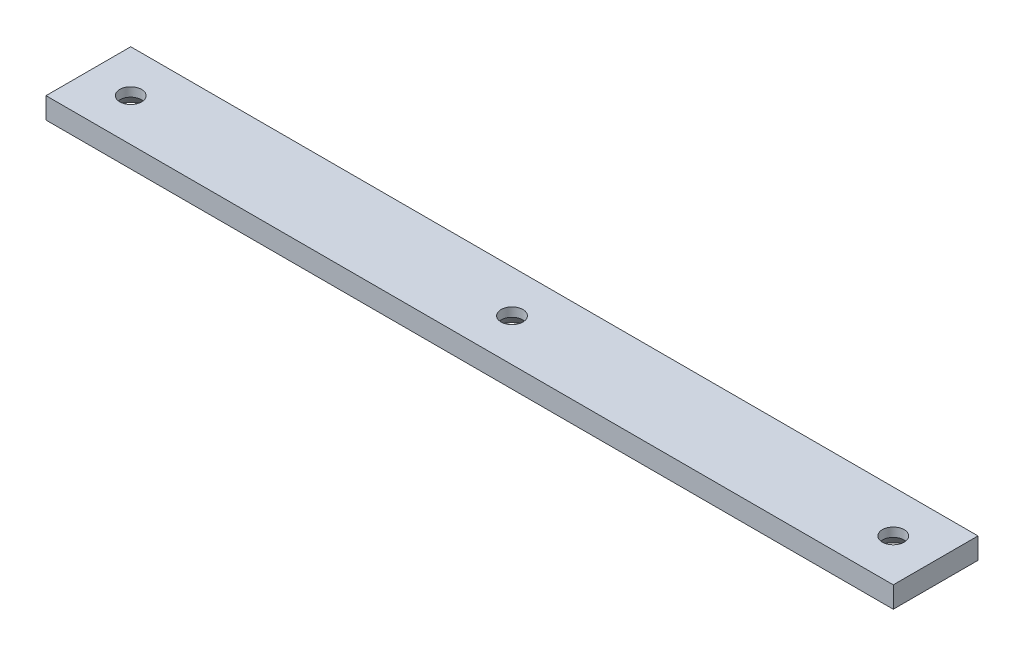
from build123d import *

# Parameters (mm, degrees)
SKETCH1_W                                     = 254
SKETCH1_H                                     = 25.4
BOSS_EXTRUDE1_DEPTH                           = 6.35
CSK_FOR_1_4_FLAT_HEAD_MACHINE_SCREW1_AT_COUNT = 2
CSK_FOR_1_4_FLAT_HEAD_MACHINE_SCREW1_AT_PITCH = 228.6
CSK_FOR_1_4_FLAT_HEAD_MACHINE_SCREW1_2_COUNT  = 2
CSK_FOR_1_4_FLAT_HEAD_MACHINE_SCREW1_2_PITCH  = 114.3


with BuildPart() as part:
    # Sketch1 → Boss-Extrude1 (new body)
    with BuildSketch(Plane(origin=(0, 0, 0), x_dir=(1, 0, 0), z_dir=(0, 1, 0))):
        with Locations((-127, 12.7)):
            Rectangle(SKETCH1_W, SKETCH1_H)
    extrude(amount=BOSS_EXTRUDE1_DEPTH)

    # Sketch7 → CSK for 1/4 Flat Head Machine Screw1 (revolve, cut)
    with BuildSketch(Plane(origin=(-241.3, 0, -12.7), x_dir=(0, 0, -1), z_dir=(1, 0, 0))):
        Polygon((0, 0), (0, 6.35), (3.2639, 6.35), (3.2639, 3.652419693), (6.4389, 0), align=None)
    csk_for_1_4_flat_head_machine_screw1 = revolve(axis=Axis((-241.3, -6.35, -12.7), (0, 1, 0)), mode=Mode.SUBTRACT)

    # CSK for 1/4 Flat Head Machine Screw1 at: CSK for 1/4 Flat Head Machine Screw1 ×2
    with Locations(*[(i * CSK_FOR_1_4_FLAT_HEAD_MACHINE_SCREW1_AT_PITCH, 0, 0) for i in range(1, CSK_FOR_1_4_FLAT_HEAD_MACHINE_SCREW1_AT_COUNT)]):
        add(csk_for_1_4_flat_head_machine_screw1, mode=Mode.SUBTRACT)

    # CSK for 1_4 Flat Head Machine Screw1 2: CSK for 1/4 Flat Head Machine Screw1 ×2
    with Locations(*[(i * CSK_FOR_1_4_FLAT_HEAD_MACHINE_SCREW1_2_PITCH, 0, 0) for i in range(1, CSK_FOR_1_4_FLAT_HEAD_MACHINE_SCREW1_2_COUNT)]):
        add(csk_for_1_4_flat_head_machine_screw1, mode=Mode.SUBTRACT)


solid = part.part
